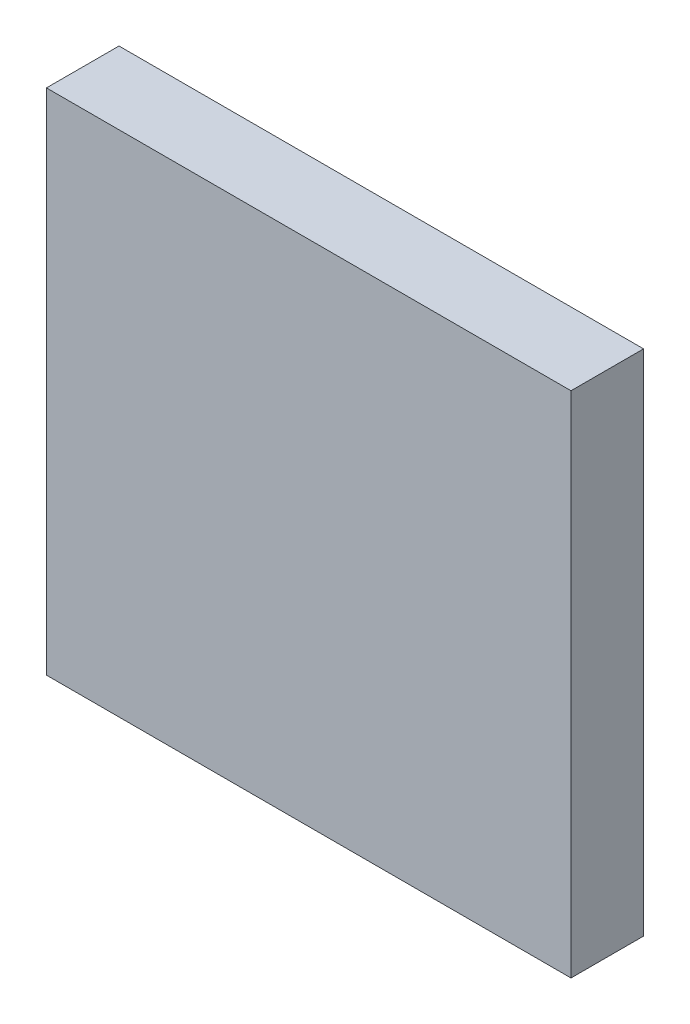
from build123d import *

# Parameters (mm, degrees)
SKETCH1_W           = 94
SKETCH1_H           = 91.14
BOSS_EXTRUDE1_DEPTH = 13


with BuildPart() as part:
    # Sketch1 → Boss-Extrude1 (new body)
    with BuildSketch(Plane.XY):
        Rectangle(SKETCH1_W, SKETCH1_H)
    extrude(amount=BOSS_EXTRUDE1_DEPTH)


solid = part.part
